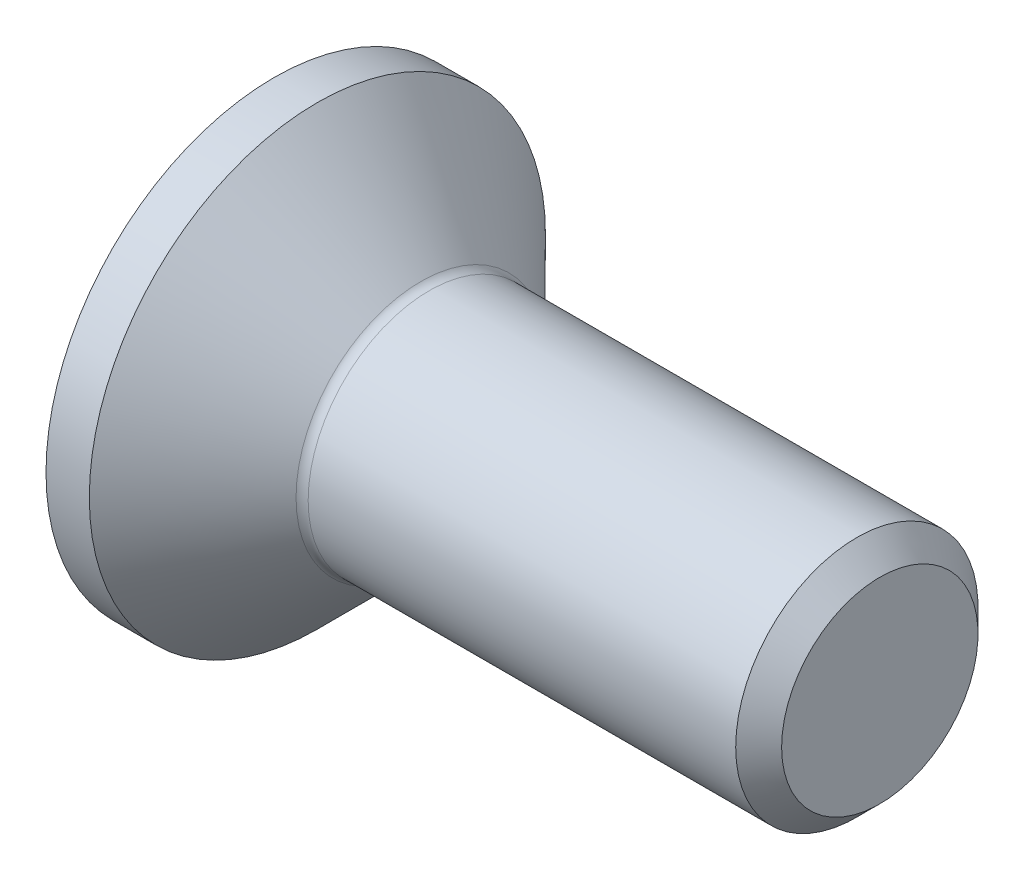
from build123d import *

# Parameters (mm, degrees)
HEXAGONSOCKET_DEPTH = 1.5
HEADFILLET_R        = 0.2
CHAMFER_2_SIZE      = 0.379
SKETCH4_W           = 5
SKETCH4_H           = 5


with BuildPart() as part:
    # Sketch1 → Base (revolve)
    with BuildSketch(Plane.XY, mode=Mode.PRIVATE) as base_sk:
        Polygon((0, 0), (0, 4.48), (2.48, 2), (10, 2), (10, 0), align=None)
    revolve(base_sk.sketch.rotate(Axis((-0.587069181, 0, 0), (1, 0, 0)), 90), axis=Axis((-0.587069181, 0, 0), (1, 0, 0)))

    # Sketch2 → HexagonSocket (cut)
    with BuildSketch(Plane(origin=(0, 0, 0), x_dir=(0, 0, -1), z_dir=(1, 0, 0))):
        Polygon((1.443375673, 0), (0.721687836, 1.25), (-0.721687836, 1.25), (-1.443375673, 0), (-0.721687836, -1.25), (0.721687836, -1.25), align=None)
    extrude(amount=HEXAGONSOCKET_DEPTH, mode=Mode.SUBTRACT)

    # Sketch3 → Cut-Revolve1 (revolve, cut)
    with BuildSketch(Plane.XY, mode=Mode.PRIVATE) as cut_revolve1_sk:
        Polygon((1.5, 1.25), (2.221687836, 0), (1.5, 0), align=None)
    revolve(cut_revolve1_sk.sketch.rotate(Axis((-0.439109555, 0, 0), (1, 0, 0)), 90), axis=Axis((-0.439109555, 0, 0), (1, 0, 0)), mode=Mode.SUBTRACT)

    # HeadFillet
    headfillet_edges = [part.edges().sort_by_distance(p)[0] for p in [
        (2.48, 0, -2),
    ]]
    fillet(headfillet_edges, radius=HEADFILLET_R)

    # Chamfer 2
    chamfer_2_edges = [part.edges().sort_by_distance(p)[0] for p in [
        (10, 0, -2),
    ]]
    chamfer(chamfer_2_edges, length=CHAMFER_2_SIZE)

    # Sketch4 → Cut-Revolve2 (revolve, cut)
    with BuildSketch(Plane(origin=(0, 0, 0), x_dir=(1, 0, 0), z_dir=(0, 1, 0)), mode=Mode.PRIVATE) as cut_revolve2_sk:
        with Locations((0.5, 6.265)):
            Rectangle(SKETCH4_W, SKETCH4_H)
    revolve(cut_revolve2_sk.sketch.rotate(Axis((11.853138686, 0, 0), (-1, 0, 0)), 180), axis=Axis((11.853138686, 0, 0), (-1, 0, 0)), mode=Mode.SUBTRACT)


solid = part.part
